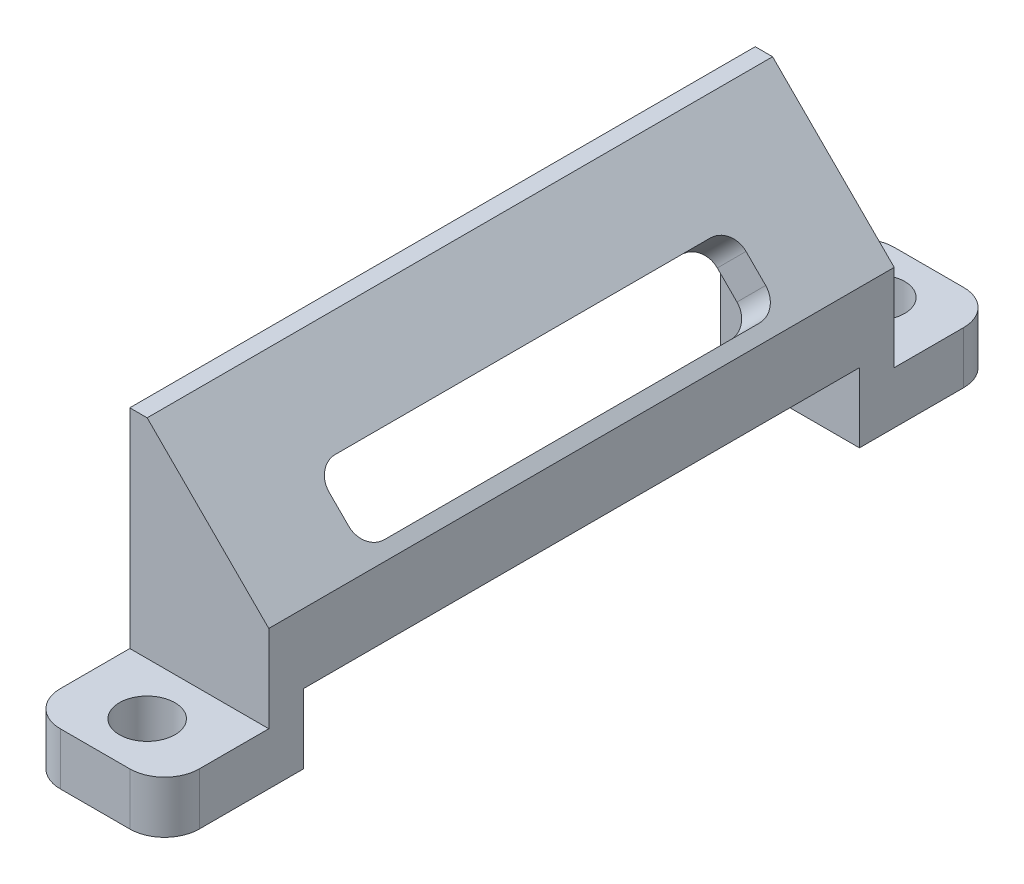
from build123d import *

# Parameters (mm, degrees)
SKETCH_1_W          = 8
SKETCH_1_H          = 15
EXTRUDE_1_DEPTH     = 48
SKETCH_2_W          = 8
SKETCH_2_H          = 6
CUT_EXTRUDE_1_DEPTH = 12
SKETCH_4_W          = 8
SKETCH_4_H          = 32
CUT_EXTRUDE_3_DEPTH = 4
SKETCH_5_R          = 1.6
CUT_EXTRUDE_4_DEPTH = 3
FILLET_1_R          = 2
CUT_EXTRUDE_5_DEPTH = 32
SKETCH_6_W          = 30
SKETCH_6_H          = 8
CUT_EXTRUDE_6_DEPTH = 1
CHAMFER_1_SIZE      = 7
FILLET_2_R          = 0.8
CUT_EXTRUDE_7_DEPTH = 10
CUT_EXTRUDE_8_DEPTH = 0.2


with BuildPart() as part:
    # 草图1 → 凸台-拉伸1 (new body)
    with BuildSketch(Plane.XY):
        with Locations((4, 7.5)):
            Rectangle(SKETCH_1_W, SKETCH_1_H)
    extrude(amount=EXTRUDE_1_DEPTH)

    # 草图2 → 切除-拉伸1 (cut)
    with BuildSketch(Plane(origin=(0, 15, 0), x_dir=(1, 0, 0), z_dir=(0, 1, 0))):
        with Locations((4, -3)):
            Rectangle(SKETCH_2_W, SKETCH_2_H)
        with Locations((4, -45)):
            Rectangle(SKETCH_2_W, SKETCH_2_H)
    extrude(amount=-CUT_EXTRUDE_1_DEPTH, mode=Mode.SUBTRACT)

    # 草图4 → 切除-拉伸3 (cut)
    with BuildSketch(Plane.XZ):
        with Locations((4, 24)):
            Rectangle(SKETCH_4_W, SKETCH_4_H)
    extrude(amount=-CUT_EXTRUDE_3_DEPTH, mode=Mode.SUBTRACT)

    # 草图5 → 切除-拉伸4 (cut)
    with BuildSketch(Plane(origin=(0, 3, 0), x_dir=(1, 0, 0), z_dir=(0, 1, 0))):
        with Locations(Location((4, -3, 0), (0, 0, 270))):
            Circle(SKETCH_5_R)
        with Locations(Location((4, -45, 0), (0, 0, 270))):
            Circle(SKETCH_5_R)
    extrude(amount=-CUT_EXTRUDE_4_DEPTH, mode=Mode.SUBTRACT)

    # 圆角1
    fillet_1_edges = [part.edges().sort_by_distance(p)[0] for p in [
        (8, 1.5, 48),
        (0, 1.5, 0),
        (0, 1.5, 48),
        (8, 1.5, 0),
    ]]
    fillet(fillet_1_edges, radius=FILLET_1_R)

    # 草图3 → 切除-拉伸5 (cut)
    with BuildSketch(Plane.XY.offset(40)):
        Polygon((0, 4), (7, 4), (0, 11), align=None)
    extrude(amount=-CUT_EXTRUDE_5_DEPTH, mode=Mode.SUBTRACT)

    # 草图6 → 切除-拉伸6 (cut)
    with BuildSketch(Plane(origin=(5.5, 5.5, 0), x_dir=(0, 0, 1), z_dir=(-0.7071067811865474, -0.7071067811865477, 0))):
        with Locations((24, 2.778174593)):
            Rectangle(SKETCH_6_W, SKETCH_6_H)
    extrude(amount=-CUT_EXTRUDE_6_DEPTH, mode=Mode.SUBTRACT)

    # 倒角1
    chamfer_1_edges = [part.edges().sort_by_distance(p)[0] for p in [
        (8, 15, 24),
    ]]
    chamfer(chamfer_1_edges, length=CHAMFER_1_SIZE)

    # 圆角2
    fillet_2_edges = [part.edges().sort_by_distance(p)[0] for p in [
        (6.717514421, 4.98959236, 9),
        (1.060660172, 10.646446609, 9),
        (1.060660172, 10.646446609, 39),
        (6.717514421, 4.98959236, 39),
    ]]
    fillet(fillet_2_edges, radius=FILLET_2_R)

    # 草图7 → 切除-拉伸7 (cut)
    with BuildSketch(Plane(origin=(6.207106781, 6.207106781, 0), x_dir=(0, 0, 1), z_dir=(-0.7071067811865475, -0.7071067811865477, 0))):
        with BuildLine():
            Line((13.2, 4.778174593), (34.8, 4.778174593))
            ThreePointArc((34.8, 4.778174593), (35.648528137, 4.42670273), (36, 3.578174593))
            Line((36, 3.578174593), (36, 1.978174593))
            ThreePointArc((36, 1.978174593), (35.648528137, 1.129646456), (34.8, 0.778174593))
            Line((34.8, 0.778174593), (13.2, 0.778174593))
            ThreePointArc((13.2, 0.778174593), (12.351471863, 1.129646456), (12, 1.978174593))
            Line((12, 1.978174593), (12, 3.578174593))
            ThreePointArc((12, 3.578174593), (12.351471863, 4.42670273), (13.2, 4.778174593))
        make_face()
    extrude(amount=-CUT_EXTRUDE_7_DEPTH, mode=Mode.SUBTRACT)

    # 草图8 → 切除-拉伸8 (cut)
    with BuildSketch(Plane(origin=(6.207106781, 6.207106781, 0), x_dir=(0, 0, 1), z_dir=(-0.7071067811865475, -0.7071067811865477, 0))):
        with BuildLine():
            Line((12, 5.528174593), (36, 5.528174593))
            ThreePointArc((36, 5.528174593), (36.707106781, 5.235281374), (37, 4.528174593))
            Line((37, 4.528174593), (37, 1.028174593))
            ThreePointArc((37, 1.028174593), (36.707106781, 0.321067812), (36, 0.028174593))
            Line((36, 0.028174593), (12, 0.028174593))
            ThreePointArc((12, 0.028174593), (11.292893219, 0.321067812), (11, 1.028174593))
            Line((11, 1.028174593), (11, 4.528174593))
            ThreePointArc((11, 4.528174593), (11.292893219, 5.235281374), (12, 5.528174593))
        make_face()
    extrude(amount=-CUT_EXTRUDE_8_DEPTH, mode=Mode.SUBTRACT)


solid = part.part
